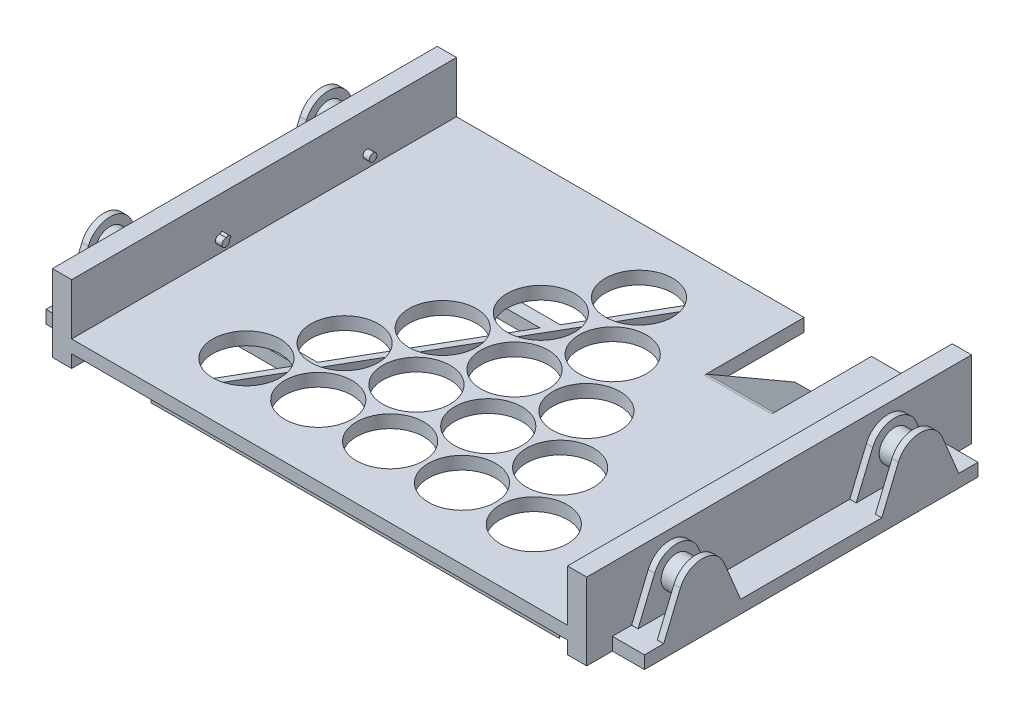
from build123d import *

# Parameters (mm, degrees)
SKETCH_2_W          = 416.5
SKETCH_2_H          = 300
EXTRUDE_1_DEPTH     = 60
EXTRUDE_4_DEPTH     = 5
SKETCH_5_R          = 12
EXTRUDE_3_DEPTH     = 20
SKETCH_8_W          = 260
SKETCH_8_H          = 10
EXTRUDE_5_DEPTH     = 15
EXTRUDE_6_DEPTH     = 5
EXTRUDE_START       = 5
EXTRUDE_8_DEPTH     = 5
EXTRUDE_START_2     = 20
SKETCH_10_R         = 12
EXTRUDE_7_DEPTH     = 20
SKETCH_13_W         = 260
SKETCH_13_H         = 10
EXTRUDE_10_DEPTH    = 15
SKETCH_14_W         = 260
SKETCH_14_H         = 10
EXTRUDE_11_DEPTH    = 5
SKETCH_15_W         = 386.5
SKETCH_15_H         = 300
CUT_EXTRUDE_2_DEPTH = 40
SKETCH_16_R         = 26.25
CUT_EXTRUDE_3_DEPTH = 10
SKETCH_17_W         = 386.5
SKETCH_17_H         = 300
CUT_EXTRUDE_4_DEPTH = 10
EXTRUDE_12_DEPTH    = 30
SKETCH_19_W         = 386.5
SKETCH_19_H         = 346.960050319
CUT_EXTRUDE_5_DEPTH = 20
SKETCH_20_R         = 3
EXTRUDE_13_DEPTH    = 5
SKETCH_22_R         = 3
EXTRUDE_14_DEPTH    = 5
EXTRUDE_15_DEPTH    = 5
SKETCH_24_W         = 52.5
SKETCH_24_H         = 76.5
CUT_EXTRUDE_6_DEPTH = 10
EXTRUDE_16_DEPTH    = 52.5
FILLET_1_R          = 5


with BuildPart() as part:
    # 草图2 → 凸台-拉伸1 (new body)
    with BuildSketch(Plane(origin=(0, 0, 0), x_dir=(1, 0, 0), z_dir=(0, 1, 0))):
        with Locations((191.75, 130)):
            Rectangle(SKETCH_2_W, SKETCH_2_H)
    extrude(amount=EXTRUDE_1_DEPTH)

    # 草图6 → 凸台-拉伸4 (add)
    with BuildSketch(Plane(origin=(400, 0, 0), x_dir=(0, 0, -1), z_dir=(1, 0, 0))):
        with BuildLine():
            Line((15, 10), (0, 10))
            Line((0, 10), (0, 0))
            Line((0, 0), (260, 0))
            Line((260, 0), (260, 10))
            Line((260, 10), (245, 10))
            Line((245, 10), (232.041510818, 41.100582022))
            ThreePointArc((232.041510818, 41.100582022), (215, 52.461618456), (197.958489182, 41.100582022))
            Line((197.958489182, 41.100582022), (185, 10))
            Line((185, 10), (170, 10))
            Line((170, 10), (90, 10))
            Line((90, 10), (75, 10))
            Line((75, 10), (62.041510818, 41.100582022))
            ThreePointArc((62.041510818, 41.100582022), (45, 52.461618456), (27.958489182, 41.100582022))
            Line((27.958489182, 41.100582022), (15, 10))
        make_face()
    extrude(amount=EXTRUDE_4_DEPTH)

    # 草图5 → 凸台-拉伸3 (add)
    with BuildSketch(Plane(origin=(400, 0, 0), x_dir=(0, 0, -1), z_dir=(1, 0, 0))):
        with Locations((215, 34)):
            Circle(SKETCH_5_R)
        with Locations(Location((45, 34, 0), (0, 0, 180))):
            Circle(SKETCH_5_R)
    extrude(amount=EXTRUDE_3_DEPTH)

    # 草图8 → 凸台-拉伸5 (add)
    with BuildSketch(Plane(origin=(405, 0, 0), x_dir=(0, 0, -1), z_dir=(1, 0, 0))):
        with Locations((130, 5)):
            Rectangle(SKETCH_8_W, SKETCH_8_H)
    extrude(amount=EXTRUDE_5_DEPTH)

    # 草图9 → 凸台-拉伸6 (add)
    with BuildSketch(Plane(origin=(420, 0, 0), x_dir=(0, 0, -1), z_dir=(1, 0, 0))):
        with BuildLine():
            Line((15, 10), (27.958489182, 41.100582022))
            ThreePointArc((27.958489182, 41.100582022), (45, 52.461618456), (62.041510818, 41.100582022))
            Line((62.041510818, 41.100582022), (75, 10))
            Line((75, 10), (185, 10))
            Line((185, 10), (197.958489182, 41.100582022))
            ThreePointArc((197.958489182, 41.100582022), (215, 52.461618456), (232.041510818, 41.100582022))
            Line((232.041510818, 41.100582022), (245, 10))
            Line((245, 10), (260, 10))
            Line((260, 10), (260, 0))
            Line((260, 0), (0, 0))
            Line((0, 0), (0, 10))
            Line((0, 10), (15, 10))
        make_face()
    extrude(amount=EXTRUDE_6_DEPTH)

    # 草图11 → 凸台-拉伸8 (add)
    with BuildSketch(Plane.ZY.offset(16.5).offset(EXTRUDE_START)):
        with BuildLine():
            Line((-245, 10), (-260, 10))
            Line((-260, 10), (-260, 0))
            Line((-260, 0), (0, 0))
            Line((0, 0), (0, 10))
            Line((0, 10), (-15, 10))
            Line((-15, 10), (-27.958489182, 41.100582022))
            ThreePointArc((-27.958489182, 41.100582022), (-45, 52.461618456), (-62.041510818, 41.100582022))
            Line((-62.041510818, 41.100582022), (-75, 10))
            Line((-75, 10), (-90, 10))
            Line((-90, 10), (-170, 10))
            Line((-170, 10), (-185, 10))
            Line((-185, 10), (-197.958489182, 41.100582022))
            ThreePointArc((-197.958489182, 41.100582022), (-215, 52.461618456), (-232.041510818, 41.100582022))
            Line((-232.041510818, 41.100582022), (-245, 10))
        make_face()
    extrude(amount=-EXTRUDE_8_DEPTH)

    # 草图10 → 凸台-拉伸7 (add)
    with BuildSketch(Plane.ZY.offset(16.5).offset(EXTRUDE_START_2)):
        with Locations((-45, 34)):
            Circle(SKETCH_10_R)
        with Locations(Location((-215, 34, 0), (0, 0, 180))):
            Circle(SKETCH_10_R)
    extrude(amount=-EXTRUDE_7_DEPTH)

    # 草图13 → 凸台-拉伸10 (add)
    with BuildSketch(Plane.ZY.offset(21.5)):
        with Locations((-130, 5)):
            Rectangle(SKETCH_13_W, SKETCH_13_H)
    extrude(amount=EXTRUDE_10_DEPTH)

    # 草图14 → 凸台-拉伸11 (add)
    with BuildSketch(Plane.ZY.offset(36.5).offset(EXTRUDE_START)):
        with Locations((-130, 5)):
            Rectangle(SKETCH_14_W, SKETCH_14_H)
        with BuildLine():
            Line((-232.041510818, 41.100582022), (-245, 10))
            Line((-245, 10), (-185, 10))
            Line((-185, 10), (-197.958489182, 41.100582022))
            ThreePointArc((-197.958489182, 41.100582022), (-215, 52.461618456), (-232.041510818, 41.100582022))
        make_face()
        with BuildLine():
            Line((-75, 10), (-15, 10))
            Line((-15, 10), (-27.958489182, 41.100582022))
            ThreePointArc((-27.958489182, 41.100582022), (-45, 52.461618456), (-62.041510818, 41.100582022))
            Line((-62.041510818, 41.100582022), (-75, 10))
        make_face()
    extrude(amount=-EXTRUDE_11_DEPTH)

    # 草图15 → 切除-拉伸2 (cut)
    with BuildSketch(Plane(origin=(0, 60, 0), x_dir=(1, 0, 0), z_dir=(0, 1, 0))):
        with Locations((191.75, 130)):
            Rectangle(SKETCH_15_W, SKETCH_15_H)
    extrude(amount=-CUT_EXTRUDE_2_DEPTH, mode=Mode.SUBTRACT)

    # 草图16 → 切除-拉伸3 (cut)
    with BuildSketch(Plane(origin=(0, 20, 0), x_dir=(1, 0, 0), z_dir=(0, 1, 0))):
        with Locations(Location((303.75, 35, 0), (0, 0, 270))):
            Circle(SKETCH_16_R)
        with Locations(Location((247.75, 35, 0), (0, 0, 270))):
            Circle(SKETCH_16_R)
        with Locations(Location((191.75, 35, 0), (0, 0, 270))):
            Circle(SKETCH_16_R)
        with Locations(Location((135.75, 35, 0), (0, 0, 270))):
            Circle(SKETCH_16_R)
        with Locations(Location((79.75, 35, 0), (0, 0, 270))):
            Circle(SKETCH_16_R)
        with Locations(Location((219.75, 83.497422612, 0), (0, 0, 270))):
            Circle(SKETCH_16_R)
        with Locations(Location((275.75, 83.497422612, 0), (0, 0, 270))):
            Circle(SKETCH_16_R)
        with Locations(Location((163.75, 83.497422612, 0), (0, 0, 270))):
            Circle(SKETCH_16_R)
        with Locations(Location((107.75, 83.497422612, 0), (0, 0, 270))):
            Circle(SKETCH_16_R)
        with Locations(Location((191.75, 131.994845224, 0), (0, 0, 270))):
            Circle(SKETCH_16_R)
        with Locations(Location((247.75, 131.994845224, 0), (0, 0, 270))):
            Circle(SKETCH_16_R)
        with Locations(Location((135.75, 131.994845224, 0), (0, 0, 270))):
            Circle(SKETCH_16_R)
        with Locations(Location((163.75, 180.492267836, 0), (0, 0, 270))):
            Circle(SKETCH_16_R)
        with Locations(Location((219.75, 180.492267836, 0), (0, 0, 270))):
            Circle(SKETCH_16_R)
        with Locations(Location((191.75, 228.989690448, 0), (0, 0, 270))):
            Circle(SKETCH_16_R)
    extrude(amount=-CUT_EXTRUDE_3_DEPTH, mode=Mode.SUBTRACT)

    # 草图17 → 切除-拉伸4 (cut)
    with BuildSketch(Plane.XZ):
        with Locations((191.75, -130)):
            Rectangle(SKETCH_17_W, SKETCH_17_H)
    extrude(amount=-CUT_EXTRUDE_4_DEPTH, mode=Mode.SUBTRACT)

    # 草图18 → 凸台-拉伸12 (add)
    with BuildSketch(Plane.XZ.offset(-10)):
        Polygon((385, -200), (239.904930741, -200), (303.413460352, -90), (385, -90), (405, -90), (405, -80), (385, -80), (309.186963044, -80), (346.546460718, -15.291451884), (350.876587737, -7.791451884), (41.283666301, -7.791451884), (32.623412263, -7.791451884), (74.313036956, -80), (-1.5, -80), (-21.5, -80), (-21.5, -90), (-1.5, -90), (80.086539648, -90), (143.595069259, -200), (-1.5, -200), (-21.5, -200), (-21.5, -210), (-1.5, -210), (149.368571951, -210), (187.419872981, -275.906786679), (191.75, -283.406786679), (234.131428049, -210), (385, -210), (405, -210), (405, -200), align=None)
        Polygon((86.75, -12.791451884), (342.216333699, -12.791451884), (309.460384119, -69.526420807), (191.75, -273.406786679), (74.039615881, -69.526420807), (41.283666301, -12.791451884), align=None, mode=Mode.SUBTRACT)
    extrude(amount=EXTRUDE_12_DEPTH)

    # 草图19 → 切除-拉伸5 (cut)
    with BuildSketch(Plane.XZ.offset(-10)):
        with Locations((191.75, -153.48002516)):
            Rectangle(SKETCH_19_W, SKETCH_19_H)
    extrude(amount=CUT_EXTRUDE_5_DEPTH, mode=Mode.SUBTRACT)

    # 草图20 → 凸台-拉伸13 (add)
    with BuildSketch(Plane(origin=(-1.5, 0, 0), x_dir=(0, 0, -1), z_dir=(1, 0, 0))):
        with Locations(Location((95, 30, 0), (0, 0, 180))):
            Circle(SKETCH_20_R)
        with Locations(Location((210, 30, 0), (0, 0, 180))):
            Circle(SKETCH_20_R)
    extrude(amount=EXTRUDE_13_DEPTH)

    # 草图22 → 凸台-拉伸14 (add)
    with BuildSketch(Plane.ZY.offset(-385).offset(EXTRUDE_START)):
        with Locations((-95, 30)):
            Circle(SKETCH_22_R)
        with Locations((-210, 30)):
            Circle(SKETCH_22_R)
    extrude(amount=-EXTRUDE_14_DEPTH)

    # 草图23 → 凸台-拉伸15 (add)
    with BuildSketch(Plane(origin=(3.5, 0, 0), x_dir=(0, 0, -1), z_dir=(1, 0, 0))):
        Polygon((95, 30), (96.13137085, 28.86862915), (99.313351365, 32.050609665), (97.050609665, 34.313351365), (93.86862915, 31.13137085), align=None)
    extrude(amount=-EXTRUDE_15_DEPTH)

    # 草图24 → 切除-拉伸6 (cut)
    with BuildSketch(Plane(origin=(0, 20, 0), x_dir=(1, 0, 0), z_dir=(0, 1, 0))):
        with Locations((295.75, 241.75)):
            Rectangle(SKETCH_24_W, SKETCH_24_H)
    extrude(amount=-CUT_EXTRUDE_6_DEPTH, mode=Mode.SUBTRACT)

    # 草图25 → 凸台-拉伸16 (add)
    with BuildSketch(Plane.ZY.offset(-322)):
        Polygon((-203.5, 20), (-272.782032303, -20), (-255.461524227, -20), (-203.5, 10), align=None)
    extrude(amount=EXTRUDE_16_DEPTH)

    # 圆角1
    fillet_1_edges = [part.edges().sort_by_distance(p)[0] for p in [
        (295.75, 20, -203.5),
    ]]
    fillet(fillet_1_edges, radius=FILLET_1_R)


solid = part.part
